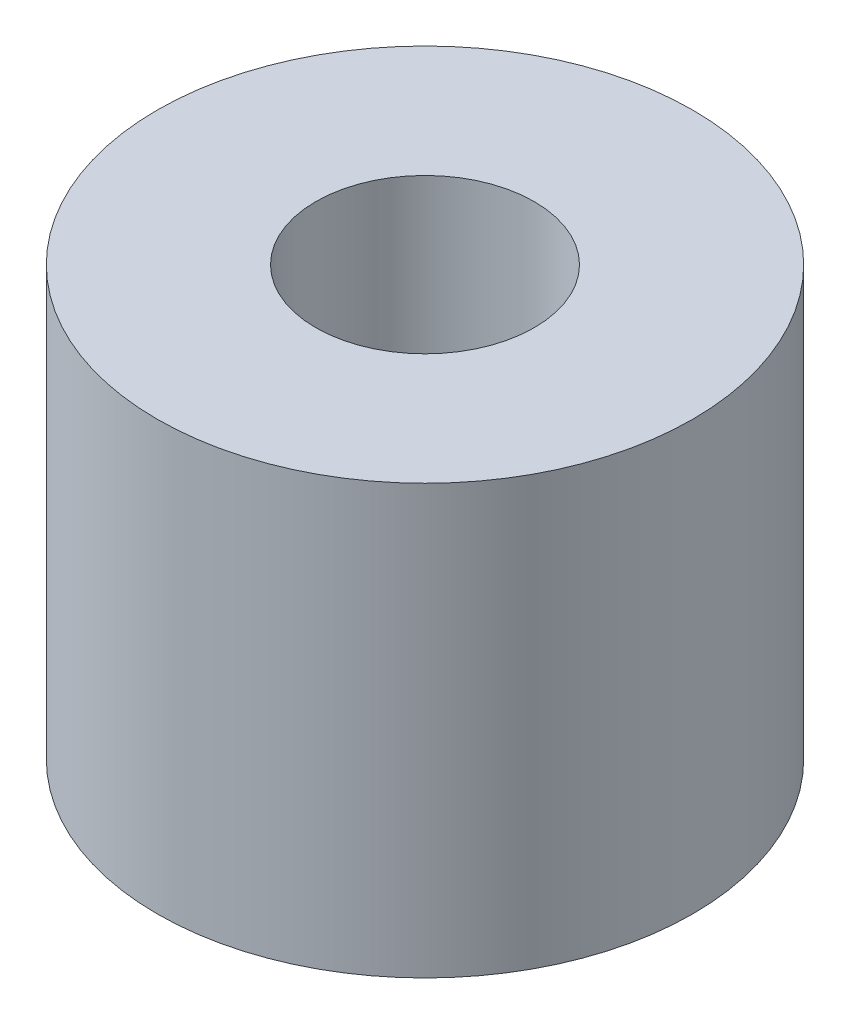
from build123d import *

# Parameters (mm, degrees)
SKETCH_1_W = 7.4
SKETCH_1_H = 20


with BuildPart() as part:
    # Эскиз1 → Повернуть1 (revolve)
    with BuildSketch(Plane.XY, mode=Mode.PRIVATE) as revolve_1_sk:
        with Locations((-8.8, 10)):
            Rectangle(SKETCH_1_W, SKETCH_1_H)
    revolve(revolve_1_sk.sketch.rotate(Axis((0, 0, 0), (0, -1, 0)), 270), axis=Axis((0, 0, 0), (0, -1, 0)))


solid = part.part
